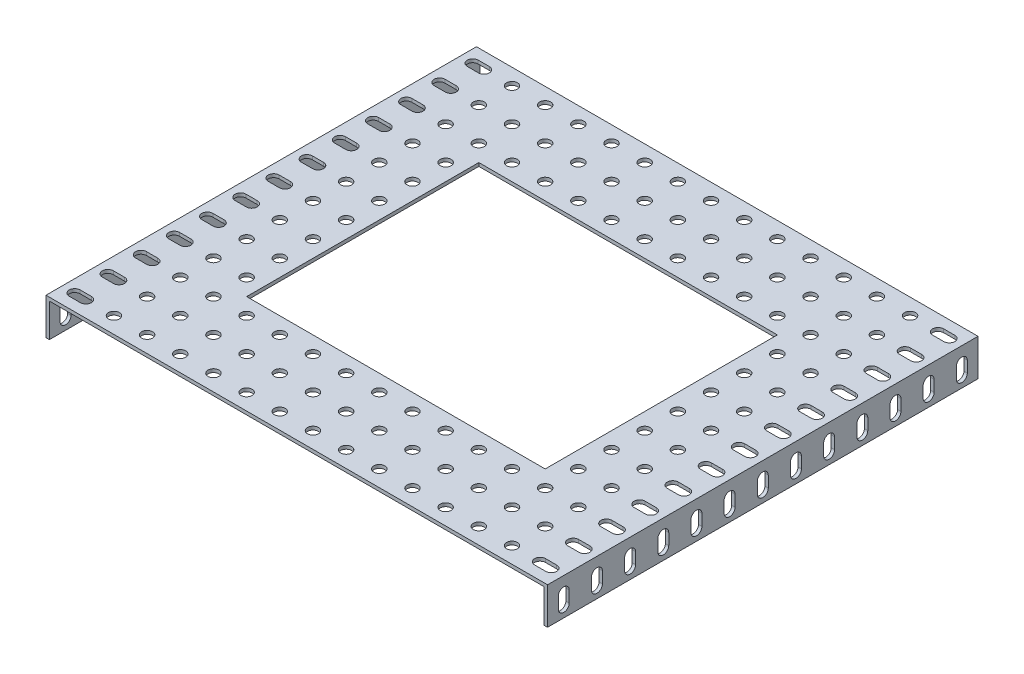
from build123d import *

# Parameters (mm, degrees)
SKETCH1_W           = 192.94
SKETCH1_H           = 165.58
SKETCH1_R           = 2.11
BOSS_EXTRUDE1_DEPTH = 1.3
SKETCH3_W           = 165.58
SKETCH3_H           = 14.16
BOSS_EXTRUDE2_DEPTH = 1.3
SKETCH4_W           = 114.84
SKETCH4_H           = 89.32
CUT_EXTRUDE1_DEPTH  = 10


with BuildPart() as part:
    # Sketch1 → Boss-Extrude1 (new body)
    with BuildSketch(Plane(origin=(0, 0, 0), x_dir=(1, 0, 0), z_dir=(0, 1, 0))):
        Rectangle(SKETCH1_W, SKETCH1_H)
        with Locations(Location((-76.56, -76.56, 0), (0, 0, 270))):
            Circle(SKETCH1_R, mode=Mode.SUBTRACT)
        with Locations(Location((-63.8, -76.56, 0), (0, 0, 270))):
            Circle(SKETCH1_R, mode=Mode.SUBTRACT)
        with Locations(Location((-51.04, -76.56, 0), (0, 0, 270))):
            Circle(SKETCH1_R, mode=Mode.SUBTRACT)
        with Locations(Location((-38.28, -76.56, 0), (0, 0, 270))):
            Circle(SKETCH1_R, mode=Mode.SUBTRACT)
        with Locations(Location((-25.52, -76.56, 0), (0, 0, 270))):
            Circle(SKETCH1_R, mode=Mode.SUBTRACT)
        with Locations(Location((-12.76, -76.56, 0), (0, 0, 270))):
            Circle(SKETCH1_R, mode=Mode.SUBTRACT)
        with Locations(Location((0, -76.56, 0), (0, 0, 270))):
            Circle(SKETCH1_R, mode=Mode.SUBTRACT)
        with Locations(Location((12.76, -76.56, 0), (0, 0, 270))):
            Circle(SKETCH1_R, mode=Mode.SUBTRACT)
        with Locations(Location((25.52, -76.56, 0), (0, 0, 270))):
            Circle(SKETCH1_R, mode=Mode.SUBTRACT)
        with Locations(Location((38.28, -76.56, 0), (0, 0, 270))):
            Circle(SKETCH1_R, mode=Mode.SUBTRACT)
        with Locations(Location((51.04, -76.56, 0), (0, 0, 270))):
            Circle(SKETCH1_R, mode=Mode.SUBTRACT)
        with Locations(Location((63.8, -76.56, 0), (0, 0, 270))):
            Circle(SKETCH1_R, mode=Mode.SUBTRACT)
        with Locations(Location((76.56, -76.56, 0), (0, 0, 270))):
            Circle(SKETCH1_R, mode=Mode.SUBTRACT)
        with Locations(Location((-63.8, -63.8, 0), (0, 0, 270))):
            Circle(SKETCH1_R, mode=Mode.SUBTRACT)
        with Locations(Location((-51.04, -63.8, 0), (0, 0, 270))):
            Circle(SKETCH1_R, mode=Mode.SUBTRACT)
        with Locations(Location((-38.28, -63.8, 0), (0, 0, 270))):
            Circle(SKETCH1_R, mode=Mode.SUBTRACT)
        with Locations(Location((-25.52, -63.8, 0), (0, 0, 270))):
            Circle(SKETCH1_R, mode=Mode.SUBTRACT)
        with Locations(Location((-12.76, -63.8, 0), (0, 0, 270))):
            Circle(SKETCH1_R, mode=Mode.SUBTRACT)
        with Locations(Location((0, -63.8, 0), (0, 0, 270))):
            Circle(SKETCH1_R, mode=Mode.SUBTRACT)
        with Locations(Location((12.76, -63.8, 0), (0, 0, 270))):
            Circle(SKETCH1_R, mode=Mode.SUBTRACT)
        with Locations(Location((25.52, -63.8, 0), (0, 0, 270))):
            Circle(SKETCH1_R, mode=Mode.SUBTRACT)
        with Locations(Location((38.28, -63.8, 0), (0, 0, 270))):
            Circle(SKETCH1_R, mode=Mode.SUBTRACT)
        with Locations(Location((51.04, -63.8, 0), (0, 0, 270))):
            Circle(SKETCH1_R, mode=Mode.SUBTRACT)
        with Locations(Location((63.8, -63.8, 0), (0, 0, 270))):
            Circle(SKETCH1_R, mode=Mode.SUBTRACT)
        with Locations(Location((76.56, -63.8, 0), (0, 0, 270))):
            Circle(SKETCH1_R, mode=Mode.SUBTRACT)
        with Locations(Location((-63.8, -51.04, 0), (0, 0, 270))):
            Circle(SKETCH1_R, mode=Mode.SUBTRACT)
        with Locations(Location((-51.04, -51.04, 0), (0, 0, 270))):
            Circle(SKETCH1_R, mode=Mode.SUBTRACT)
        with Locations(Location((-38.28, -51.04, 0), (0, 0, 270))):
            Circle(SKETCH1_R, mode=Mode.SUBTRACT)
        with Locations(Location((-25.52, -51.04, 0), (0, 0, 270))):
            Circle(SKETCH1_R, mode=Mode.SUBTRACT)
        with Locations(Location((-12.76, -51.04, 0), (0, 0, 270))):
            Circle(SKETCH1_R, mode=Mode.SUBTRACT)
        with Locations(Location((0, -51.04, 0), (0, 0, 270))):
            Circle(SKETCH1_R, mode=Mode.SUBTRACT)
        with Locations(Location((12.76, -51.04, 0), (0, 0, 270))):
            Circle(SKETCH1_R, mode=Mode.SUBTRACT)
        with Locations(Location((25.52, -51.04, 0), (0, 0, 270))):
            Circle(SKETCH1_R, mode=Mode.SUBTRACT)
        with Locations(Location((38.28, -51.04, 0), (0, 0, 270))):
            Circle(SKETCH1_R, mode=Mode.SUBTRACT)
        with Locations(Location((51.04, -51.04, 0), (0, 0, 270))):
            Circle(SKETCH1_R, mode=Mode.SUBTRACT)
        with Locations(Location((63.8, -51.04, 0), (0, 0, 270))):
            Circle(SKETCH1_R, mode=Mode.SUBTRACT)
        with Locations(Location((76.56, -51.04, 0), (0, 0, 270))):
            Circle(SKETCH1_R, mode=Mode.SUBTRACT)
        with Locations(Location((-63.8, -38.28, 0), (0, 0, 270))):
            Circle(SKETCH1_R, mode=Mode.SUBTRACT)
        with Locations(Location((-51.04, -38.28, 0), (0, 0, 270))):
            Circle(SKETCH1_R, mode=Mode.SUBTRACT)
        with Locations(Location((-38.28, -38.28, 0), (0, 0, 270))):
            Circle(SKETCH1_R, mode=Mode.SUBTRACT)
        with Locations(Location((-25.52, -38.28, 0), (0, 0, 270))):
            Circle(SKETCH1_R, mode=Mode.SUBTRACT)
        with Locations(Location((-12.76, -38.28, 0), (0, 0, 270))):
            Circle(SKETCH1_R, mode=Mode.SUBTRACT)
        with Locations(Location((0, -38.28, 0), (0, 0, 270))):
            Circle(SKETCH1_R, mode=Mode.SUBTRACT)
        with Locations(Location((12.76, -38.28, 0), (0, 0, 270))):
            Circle(SKETCH1_R, mode=Mode.SUBTRACT)
        with Locations(Location((25.52, -38.28, 0), (0, 0, 270))):
            Circle(SKETCH1_R, mode=Mode.SUBTRACT)
        with Locations(Location((38.28, -38.28, 0), (0, 0, 270))):
            Circle(SKETCH1_R, mode=Mode.SUBTRACT)
        with Locations(Location((51.04, -38.28, 0), (0, 0, 270))):
            Circle(SKETCH1_R, mode=Mode.SUBTRACT)
        with Locations(Location((63.8, -38.28, 0), (0, 0, 270))):
            Circle(SKETCH1_R, mode=Mode.SUBTRACT)
        with Locations(Location((76.56, -38.28, 0), (0, 0, 270))):
            Circle(SKETCH1_R, mode=Mode.SUBTRACT)
        with Locations(Location((-63.8, -25.52, 0), (0, 0, 270))):
            Circle(SKETCH1_R, mode=Mode.SUBTRACT)
        with Locations(Location((-51.04, -25.52, 0), (0, 0, 270))):
            Circle(SKETCH1_R, mode=Mode.SUBTRACT)
        with Locations(Location((-38.28, -25.52, 0), (0, 0, 270))):
            Circle(SKETCH1_R, mode=Mode.SUBTRACT)
        with Locations(Location((-25.52, -25.52, 0), (0, 0, 270))):
            Circle(SKETCH1_R, mode=Mode.SUBTRACT)
        with Locations(Location((-12.76, -25.52, 0), (0, 0, 270))):
            Circle(SKETCH1_R, mode=Mode.SUBTRACT)
        with Locations(Location((0, -25.52, 0), (0, 0, 270))):
            Circle(SKETCH1_R, mode=Mode.SUBTRACT)
        with Locations(Location((12.76, -25.52, 0), (0, 0, 270))):
            Circle(SKETCH1_R, mode=Mode.SUBTRACT)
        with Locations(Location((25.52, -25.52, 0), (0, 0, 270))):
            Circle(SKETCH1_R, mode=Mode.SUBTRACT)
        with Locations(Location((38.28, -25.52, 0), (0, 0, 270))):
            Circle(SKETCH1_R, mode=Mode.SUBTRACT)
        with Locations(Location((51.04, -25.52, 0), (0, 0, 270))):
            Circle(SKETCH1_R, mode=Mode.SUBTRACT)
        with Locations(Location((63.8, -25.52, 0), (0, 0, 270))):
            Circle(SKETCH1_R, mode=Mode.SUBTRACT)
        with Locations(Location((76.56, -25.52, 0), (0, 0, 270))):
            Circle(SKETCH1_R, mode=Mode.SUBTRACT)
        with Locations(Location((-63.8, -12.76, 0), (0, 0, 270))):
            Circle(SKETCH1_R, mode=Mode.SUBTRACT)
        with Locations(Location((-51.04, -12.76, 0), (0, 0, 270))):
            Circle(SKETCH1_R, mode=Mode.SUBTRACT)
        with Locations(Location((-38.28, -12.76, 0), (0, 0, 270))):
            Circle(SKETCH1_R, mode=Mode.SUBTRACT)
        with Locations(Location((-25.52, -12.76, 0), (0, 0, 270))):
            Circle(SKETCH1_R, mode=Mode.SUBTRACT)
        with Locations(Location((-12.76, -12.76, 0), (0, 0, 270))):
            Circle(SKETCH1_R, mode=Mode.SUBTRACT)
        with Locations(Location((0, -12.76, 0), (0, 0, 270))):
            Circle(SKETCH1_R, mode=Mode.SUBTRACT)
        with Locations(Location((12.76, -12.76, 0), (0, 0, 270))):
            Circle(SKETCH1_R, mode=Mode.SUBTRACT)
        with Locations(Location((25.52, -12.76, 0), (0, 0, 270))):
            Circle(SKETCH1_R, mode=Mode.SUBTRACT)
        with Locations(Location((38.28, -12.76, 0), (0, 0, 270))):
            Circle(SKETCH1_R, mode=Mode.SUBTRACT)
        with Locations(Location((51.04, -12.76, 0), (0, 0, 270))):
            Circle(SKETCH1_R, mode=Mode.SUBTRACT)
        with Locations(Location((63.8, -12.76, 0), (0, 0, 270))):
            Circle(SKETCH1_R, mode=Mode.SUBTRACT)
        with Locations(Location((76.56, -12.76, 0), (0, 0, 270))):
            Circle(SKETCH1_R, mode=Mode.SUBTRACT)
        with Locations(Location((-63.8, 0, 0), (0, 0, 270))):
            Circle(SKETCH1_R, mode=Mode.SUBTRACT)
        with Locations(Location((-51.04, 0, 0), (0, 0, 270))):
            Circle(SKETCH1_R, mode=Mode.SUBTRACT)
        with Locations(Location((-38.28, 0, 0), (0, 0, 270))):
            Circle(SKETCH1_R, mode=Mode.SUBTRACT)
        with Locations(Location((-25.52, 0, 0), (0, 0, 270))):
            Circle(SKETCH1_R, mode=Mode.SUBTRACT)
        with Locations(Location((-12.76, 0, 0), (0, 0, 270))):
            Circle(SKETCH1_R, mode=Mode.SUBTRACT)
        with Locations(Location((0, 0, 0), (0, 0, 270))):
            Circle(SKETCH1_R, mode=Mode.SUBTRACT)
        with Locations(Location((12.76, 0, 0), (0, 0, 270))):
            Circle(SKETCH1_R, mode=Mode.SUBTRACT)
        with Locations(Location((25.52, 0, 0), (0, 0, 270))):
            Circle(SKETCH1_R, mode=Mode.SUBTRACT)
        with Locations(Location((38.28, 0, 0), (0, 0, 270))):
            Circle(SKETCH1_R, mode=Mode.SUBTRACT)
        with Locations(Location((51.04, 0, 0), (0, 0, 270))):
            Circle(SKETCH1_R, mode=Mode.SUBTRACT)
        with Locations(Location((63.8, 0, 0), (0, 0, 270))):
            Circle(SKETCH1_R, mode=Mode.SUBTRACT)
        with Locations(Location((76.56, 0, 0), (0, 0, 270))):
            Circle(SKETCH1_R, mode=Mode.SUBTRACT)
        with Locations(Location((-63.8, 12.76, 0), (0, 0, 270))):
            Circle(SKETCH1_R, mode=Mode.SUBTRACT)
        with Locations(Location((-51.04, 12.76, 0), (0, 0, 270))):
            Circle(SKETCH1_R, mode=Mode.SUBTRACT)
        with Locations(Location((-38.28, 12.76, 0), (0, 0, 270))):
            Circle(SKETCH1_R, mode=Mode.SUBTRACT)
        with Locations(Location((-25.52, 12.76, 0), (0, 0, 270))):
            Circle(SKETCH1_R, mode=Mode.SUBTRACT)
        with Locations(Location((-12.76, 12.76, 0), (0, 0, 270))):
            Circle(SKETCH1_R, mode=Mode.SUBTRACT)
        with Locations(Location((0, 12.76, 0), (0, 0, 270))):
            Circle(SKETCH1_R, mode=Mode.SUBTRACT)
        with Locations(Location((12.76, 12.76, 0), (0, 0, 270))):
            Circle(SKETCH1_R, mode=Mode.SUBTRACT)
        with Locations(Location((25.52, 12.76, 0), (0, 0, 270))):
            Circle(SKETCH1_R, mode=Mode.SUBTRACT)
        with Locations(Location((38.28, 12.76, 0), (0, 0, 270))):
            Circle(SKETCH1_R, mode=Mode.SUBTRACT)
        with Locations(Location((51.04, 12.76, 0), (0, 0, 270))):
            Circle(SKETCH1_R, mode=Mode.SUBTRACT)
        with Locations(Location((63.8, 12.76, 0), (0, 0, 270))):
            Circle(SKETCH1_R, mode=Mode.SUBTRACT)
        with Locations(Location((76.56, 12.76, 0), (0, 0, 270))):
            Circle(SKETCH1_R, mode=Mode.SUBTRACT)
        with Locations(Location((-63.8, 25.52, 0), (0, 0, 270))):
            Circle(SKETCH1_R, mode=Mode.SUBTRACT)
        with Locations(Location((-51.04, 25.52, 0), (0, 0, 270))):
            Circle(SKETCH1_R, mode=Mode.SUBTRACT)
        with Locations(Location((-38.28, 25.52, 0), (0, 0, 270))):
            Circle(SKETCH1_R, mode=Mode.SUBTRACT)
        with Locations(Location((-25.52, 25.52, 0), (0, 0, 270))):
            Circle(SKETCH1_R, mode=Mode.SUBTRACT)
        with Locations(Location((-12.76, 25.52, 0), (0, 0, 270))):
            Circle(SKETCH1_R, mode=Mode.SUBTRACT)
        with Locations(Location((0, 25.52, 0), (0, 0, 270))):
            Circle(SKETCH1_R, mode=Mode.SUBTRACT)
        with Locations(Location((12.76, 25.52, 0), (0, 0, 270))):
            Circle(SKETCH1_R, mode=Mode.SUBTRACT)
        with Locations(Location((25.52, 25.52, 0), (0, 0, 270))):
            Circle(SKETCH1_R, mode=Mode.SUBTRACT)
        with Locations(Location((38.28, 25.52, 0), (0, 0, 270))):
            Circle(SKETCH1_R, mode=Mode.SUBTRACT)
        with Locations(Location((51.04, 25.52, 0), (0, 0, 270))):
            Circle(SKETCH1_R, mode=Mode.SUBTRACT)
        with Locations(Location((63.8, 25.52, 0), (0, 0, 270))):
            Circle(SKETCH1_R, mode=Mode.SUBTRACT)
        with Locations(Location((76.56, 25.52, 0), (0, 0, 270))):
            Circle(SKETCH1_R, mode=Mode.SUBTRACT)
        with Locations(Location((-63.8, 38.28, 0), (0, 0, 270))):
            Circle(SKETCH1_R, mode=Mode.SUBTRACT)
        with Locations(Location((-51.04, 38.28, 0), (0, 0, 270))):
            Circle(SKETCH1_R, mode=Mode.SUBTRACT)
        with Locations(Location((-38.28, 38.28, 0), (0, 0, 270))):
            Circle(SKETCH1_R, mode=Mode.SUBTRACT)
        with Locations(Location((-25.52, 38.28, 0), (0, 0, 270))):
            Circle(SKETCH1_R, mode=Mode.SUBTRACT)
        with Locations(Location((-12.76, 38.28, 0), (0, 0, 270))):
            Circle(SKETCH1_R, mode=Mode.SUBTRACT)
        with Locations(Location((0, 38.28, 0), (0, 0, 270))):
            Circle(SKETCH1_R, mode=Mode.SUBTRACT)
        with Locations(Location((12.76, 38.28, 0), (0, 0, 270))):
            Circle(SKETCH1_R, mode=Mode.SUBTRACT)
        with Locations(Location((25.52, 38.28, 0), (0, 0, 270))):
            Circle(SKETCH1_R, mode=Mode.SUBTRACT)
        with Locations(Location((38.28, 38.28, 0), (0, 0, 270))):
            Circle(SKETCH1_R, mode=Mode.SUBTRACT)
        with Locations(Location((51.04, 38.28, 0), (0, 0, 270))):
            Circle(SKETCH1_R, mode=Mode.SUBTRACT)
        with Locations(Location((63.8, 38.28, 0), (0, 0, 270))):
            Circle(SKETCH1_R, mode=Mode.SUBTRACT)
        with Locations(Location((76.56, 38.28, 0), (0, 0, 270))):
            Circle(SKETCH1_R, mode=Mode.SUBTRACT)
        with Locations(Location((-63.8, 51.04, 0), (0, 0, 270))):
            Circle(SKETCH1_R, mode=Mode.SUBTRACT)
        with Locations(Location((-51.04, 51.04, 0), (0, 0, 270))):
            Circle(SKETCH1_R, mode=Mode.SUBTRACT)
        with Locations(Location((-38.28, 51.04, 0), (0, 0, 270))):
            Circle(SKETCH1_R, mode=Mode.SUBTRACT)
        with Locations(Location((-25.52, 51.04, 0), (0, 0, 270))):
            Circle(SKETCH1_R, mode=Mode.SUBTRACT)
        with Locations(Location((-12.76, 51.04, 0), (0, 0, 270))):
            Circle(SKETCH1_R, mode=Mode.SUBTRACT)
        with Locations(Location((0, 51.04, 0), (0, 0, 270))):
            Circle(SKETCH1_R, mode=Mode.SUBTRACT)
        with Locations(Location((12.76, 51.04, 0), (0, 0, 270))):
            Circle(SKETCH1_R, mode=Mode.SUBTRACT)
        with Locations(Location((25.52, 51.04, 0), (0, 0, 270))):
            Circle(SKETCH1_R, mode=Mode.SUBTRACT)
        with Locations(Location((38.28, 51.04, 0), (0, 0, 270))):
            Circle(SKETCH1_R, mode=Mode.SUBTRACT)
        with Locations(Location((51.04, 51.04, 0), (0, 0, 270))):
            Circle(SKETCH1_R, mode=Mode.SUBTRACT)
        with Locations(Location((63.8, 51.04, 0), (0, 0, 270))):
            Circle(SKETCH1_R, mode=Mode.SUBTRACT)
        with Locations(Location((76.56, 51.04, 0), (0, 0, 270))):
            Circle(SKETCH1_R, mode=Mode.SUBTRACT)
        with Locations(Location((-63.8, 63.8, 0), (0, 0, 270))):
            Circle(SKETCH1_R, mode=Mode.SUBTRACT)
        with Locations(Location((-51.04, 63.8, 0), (0, 0, 270))):
            Circle(SKETCH1_R, mode=Mode.SUBTRACT)
        with Locations(Location((-38.28, 63.8, 0), (0, 0, 270))):
            Circle(SKETCH1_R, mode=Mode.SUBTRACT)
        with Locations(Location((-25.52, 63.8, 0), (0, 0, 270))):
            Circle(SKETCH1_R, mode=Mode.SUBTRACT)
        with Locations(Location((-12.76, 63.8, 0), (0, 0, 270))):
            Circle(SKETCH1_R, mode=Mode.SUBTRACT)
        with Locations(Location((0, 63.8, 0), (0, 0, 270))):
            Circle(SKETCH1_R, mode=Mode.SUBTRACT)
        with Locations(Location((12.76, 63.8, 0), (0, 0, 270))):
            Circle(SKETCH1_R, mode=Mode.SUBTRACT)
        with Locations(Location((25.52, 63.8, 0), (0, 0, 270))):
            Circle(SKETCH1_R, mode=Mode.SUBTRACT)
        with Locations(Location((38.28, 63.8, 0), (0, 0, 270))):
            Circle(SKETCH1_R, mode=Mode.SUBTRACT)
        with Locations(Location((51.04, 63.8, 0), (0, 0, 270))):
            Circle(SKETCH1_R, mode=Mode.SUBTRACT)
        with Locations(Location((63.8, 63.8, 0), (0, 0, 270))):
            Circle(SKETCH1_R, mode=Mode.SUBTRACT)
        with Locations(Location((76.56, 63.8, 0), (0, 0, 270))):
            Circle(SKETCH1_R, mode=Mode.SUBTRACT)
        with Locations(Location((-63.8, 76.56, 0), (0, 0, 270))):
            Circle(SKETCH1_R, mode=Mode.SUBTRACT)
        with Locations(Location((-51.04, 76.56, 0), (0, 0, 270))):
            Circle(SKETCH1_R, mode=Mode.SUBTRACT)
        with Locations(Location((-38.28, 76.56, 0), (0, 0, 270))):
            Circle(SKETCH1_R, mode=Mode.SUBTRACT)
        with Locations(Location((-25.52, 76.56, 0), (0, 0, 270))):
            Circle(SKETCH1_R, mode=Mode.SUBTRACT)
        with Locations(Location((-12.76, 76.56, 0), (0, 0, 270))):
            Circle(SKETCH1_R, mode=Mode.SUBTRACT)
        with Locations(Location((0, 76.56, 0), (0, 0, 270))):
            Circle(SKETCH1_R, mode=Mode.SUBTRACT)
        with Locations(Location((12.76, 76.56, 0), (0, 0, 270))):
            Circle(SKETCH1_R, mode=Mode.SUBTRACT)
        with Locations(Location((25.52, 76.56, 0), (0, 0, 270))):
            Circle(SKETCH1_R, mode=Mode.SUBTRACT)
        with Locations(Location((38.28, 76.56, 0), (0, 0, 270))):
            Circle(SKETCH1_R, mode=Mode.SUBTRACT)
        with Locations(Location((51.04, 76.56, 0), (0, 0, 270))):
            Circle(SKETCH1_R, mode=Mode.SUBTRACT)
        with Locations(Location((63.8, 76.56, 0), (0, 0, 270))):
            Circle(SKETCH1_R, mode=Mode.SUBTRACT)
        with Locations(Location((76.56, 76.56, 0), (0, 0, 270))):
            Circle(SKETCH1_R, mode=Mode.SUBTRACT)
        with Locations(Location((-76.56, -63.8, 0), (0, 0, 270))):
            Circle(SKETCH1_R, mode=Mode.SUBTRACT)
        with Locations(Location((-76.56, -51.04, 0), (0, 0, 270))):
            Circle(SKETCH1_R, mode=Mode.SUBTRACT)
        with Locations(Location((-76.56, -38.28, 0), (0, 0, 270))):
            Circle(SKETCH1_R, mode=Mode.SUBTRACT)
        with Locations(Location((-76.56, -25.52, 0), (0, 0, 270))):
            Circle(SKETCH1_R, mode=Mode.SUBTRACT)
        with Locations(Location((-76.56, -12.76, 0), (0, 0, 270))):
            Circle(SKETCH1_R, mode=Mode.SUBTRACT)
        with Locations(Location((-76.56, 0, 0), (0, 0, 270))):
            Circle(SKETCH1_R, mode=Mode.SUBTRACT)
        with Locations(Location((-76.56, 12.76, 0), (0, 0, 270))):
            Circle(SKETCH1_R, mode=Mode.SUBTRACT)
        with Locations(Location((-76.56, 25.52, 0), (0, 0, 270))):
            Circle(SKETCH1_R, mode=Mode.SUBTRACT)
        with Locations(Location((-76.56, 38.28, 0), (0, 0, 270))):
            Circle(SKETCH1_R, mode=Mode.SUBTRACT)
        with Locations(Location((-76.56, 51.04, 0), (0, 0, 270))):
            Circle(SKETCH1_R, mode=Mode.SUBTRACT)
        with Locations(Location((-76.56, 63.8, 0), (0, 0, 270))):
            Circle(SKETCH1_R, mode=Mode.SUBTRACT)
        with Locations(Location((-76.56, 76.56, 0), (0, 0, 270))):
            Circle(SKETCH1_R, mode=Mode.SUBTRACT)
        with BuildLine():
            Line((-91.66, 78.67), (-87.36, 78.67))
            ThreePointArc((-87.36, 78.67), (-85.25, 76.56), (-87.36, 74.45))
            Line((-87.36, 74.45), (-91.66, 74.45))
            ThreePointArc((-91.66, 74.45), (-93.77, 76.56), (-91.66, 78.67))
        make_face(mode=Mode.SUBTRACT)
        with BuildLine():
            Line((-91.66, 65.91), (-87.36, 65.91))
            ThreePointArc((-87.36, 65.91), (-85.25, 63.8), (-87.36, 61.69))
            Line((-87.36, 61.69), (-91.66, 61.69))
            ThreePointArc((-91.66, 61.69), (-93.77, 63.8), (-91.66, 65.91))
        make_face(mode=Mode.SUBTRACT)
        with BuildLine():
            Line((-91.66, 53.15), (-87.36, 53.15))
            ThreePointArc((-87.36, 53.15), (-85.25, 51.04), (-87.36, 48.93))
            Line((-87.36, 48.93), (-91.66, 48.93))
            ThreePointArc((-91.66, 48.93), (-93.77, 51.04), (-91.66, 53.15))
        make_face(mode=Mode.SUBTRACT)
        with BuildLine():
            Line((-91.66, 40.39), (-87.36, 40.39))
            ThreePointArc((-87.36, 40.39), (-85.25, 38.28), (-87.36, 36.17))
            Line((-87.36, 36.17), (-91.66, 36.17))
            ThreePointArc((-91.66, 36.17), (-93.77, 38.28), (-91.66, 40.39))
        make_face(mode=Mode.SUBTRACT)
        with BuildLine():
            Line((-91.66, 27.63), (-87.36, 27.63))
            ThreePointArc((-87.36, 27.63), (-85.25, 25.52), (-87.36, 23.41))
            Line((-87.36, 23.41), (-91.66, 23.41))
            ThreePointArc((-91.66, 23.41), (-93.77, 25.52), (-91.66, 27.63))
        make_face(mode=Mode.SUBTRACT)
        with BuildLine():
            Line((-91.66, 14.87), (-87.36, 14.87))
            ThreePointArc((-87.36, 14.87), (-85.25, 12.76), (-87.36, 10.65))
            Line((-87.36, 10.65), (-91.66, 10.65))
            ThreePointArc((-91.66, 10.65), (-93.77, 12.76), (-91.66, 14.87))
        make_face(mode=Mode.SUBTRACT)
        with BuildLine():
            Line((-91.66, 2.11), (-87.36, 2.11))
            ThreePointArc((-87.36, 2.11), (-85.25, 0), (-87.36, -2.11))
            Line((-87.36, -2.11), (-91.66, -2.11))
            ThreePointArc((-91.66, -2.11), (-93.77, 0), (-91.66, 2.11))
        make_face(mode=Mode.SUBTRACT)
        with BuildLine():
            Line((-91.66, -10.65), (-87.36, -10.65))
            ThreePointArc((-87.36, -10.65), (-85.25, -12.76), (-87.36, -14.87))
            Line((-87.36, -14.87), (-91.66, -14.87))
            ThreePointArc((-91.66, -14.87), (-93.77, -12.76), (-91.66, -10.65))
        make_face(mode=Mode.SUBTRACT)
        with BuildLine():
            Line((-91.66, -23.41), (-87.36, -23.41))
            ThreePointArc((-87.36, -23.41), (-85.25, -25.52), (-87.36, -27.63))
            Line((-87.36, -27.63), (-91.66, -27.63))
            ThreePointArc((-91.66, -27.63), (-93.77, -25.52), (-91.66, -23.41))
        make_face(mode=Mode.SUBTRACT)
        with BuildLine():
            Line((-91.66, -36.17), (-87.36, -36.17))
            ThreePointArc((-87.36, -36.17), (-85.25, -38.28), (-87.36, -40.39))
            Line((-87.36, -40.39), (-91.66, -40.39))
            ThreePointArc((-91.66, -40.39), (-93.77, -38.28), (-91.66, -36.17))
        make_face(mode=Mode.SUBTRACT)
        with BuildLine():
            Line((-91.66, -48.93), (-87.36, -48.93))
            ThreePointArc((-87.36, -48.93), (-85.25, -51.04), (-87.36, -53.15))
            Line((-87.36, -53.15), (-91.66, -53.15))
            ThreePointArc((-91.66, -53.15), (-93.77, -51.04), (-91.66, -48.93))
        make_face(mode=Mode.SUBTRACT)
        with BuildLine():
            Line((-91.66, -61.69), (-87.36, -61.69))
            ThreePointArc((-87.36, -61.69), (-85.25, -63.8), (-87.36, -65.91))
            Line((-87.36, -65.91), (-91.66, -65.91))
            ThreePointArc((-91.66, -65.91), (-93.77, -63.8), (-91.66, -61.69))
        make_face(mode=Mode.SUBTRACT)
        with BuildLine():
            Line((-91.66, -74.45), (-87.36, -74.45))
            ThreePointArc((-87.36, -74.45), (-85.25, -76.56), (-87.36, -78.67))
            Line((-87.36, -78.67), (-91.66, -78.67))
            ThreePointArc((-91.66, -78.67), (-93.77, -76.56), (-91.66, -74.45))
        make_face(mode=Mode.SUBTRACT)
        with BuildLine():
            Line((91.66, 78.67), (87.36, 78.67))
            ThreePointArc((87.36, 78.67), (85.25, 76.56), (87.36, 74.45))
            Line((87.36, 74.45), (91.66, 74.45))
            ThreePointArc((91.66, 74.45), (93.77, 76.56), (91.66, 78.67))
        make_face(mode=Mode.SUBTRACT)
        with BuildLine():
            Line((91.66, 65.91), (87.36, 65.91))
            ThreePointArc((87.36, 65.91), (85.25, 63.8), (87.36, 61.69))
            Line((87.36, 61.69), (91.66, 61.69))
            ThreePointArc((91.66, 61.69), (93.77, 63.8), (91.66, 65.91))
        make_face(mode=Mode.SUBTRACT)
        with BuildLine():
            Line((91.66, 53.15), (87.36, 53.15))
            ThreePointArc((87.36, 53.15), (85.25, 51.04), (87.36, 48.93))
            Line((87.36, 48.93), (91.66, 48.93))
            ThreePointArc((91.66, 48.93), (93.77, 51.04), (91.66, 53.15))
        make_face(mode=Mode.SUBTRACT)
        with BuildLine():
            Line((91.66, 40.39), (87.36, 40.39))
            ThreePointArc((87.36, 40.39), (85.25, 38.28), (87.36, 36.17))
            Line((87.36, 36.17), (91.66, 36.17))
            ThreePointArc((91.66, 36.17), (93.77, 38.28), (91.66, 40.39))
        make_face(mode=Mode.SUBTRACT)
        with BuildLine():
            Line((91.66, 27.63), (87.36, 27.63))
            ThreePointArc((87.36, 27.63), (85.25, 25.52), (87.36, 23.41))
            Line((87.36, 23.41), (91.66, 23.41))
            ThreePointArc((91.66, 23.41), (93.77, 25.52), (91.66, 27.63))
        make_face(mode=Mode.SUBTRACT)
        with BuildLine():
            Line((91.66, 14.87), (87.36, 14.87))
            ThreePointArc((87.36, 14.87), (85.25, 12.76), (87.36, 10.65))
            Line((87.36, 10.65), (91.66, 10.65))
            ThreePointArc((91.66, 10.65), (93.77, 12.76), (91.66, 14.87))
        make_face(mode=Mode.SUBTRACT)
        with BuildLine():
            Line((91.66, 2.11), (87.36, 2.11))
            ThreePointArc((87.36, 2.11), (85.25, 0), (87.36, -2.11))
            Line((87.36, -2.11), (91.66, -2.11))
            ThreePointArc((91.66, -2.11), (93.77, 0), (91.66, 2.11))
        make_face(mode=Mode.SUBTRACT)
        with BuildLine():
            Line((91.66, -10.65), (87.36, -10.65))
            ThreePointArc((87.36, -10.65), (85.25, -12.76), (87.36, -14.87))
            Line((87.36, -14.87), (91.66, -14.87))
            ThreePointArc((91.66, -14.87), (93.77, -12.76), (91.66, -10.65))
        make_face(mode=Mode.SUBTRACT)
        with BuildLine():
            Line((91.66, -23.41), (87.36, -23.41))
            ThreePointArc((87.36, -23.41), (85.25, -25.52), (87.36, -27.63))
            Line((87.36, -27.63), (91.66, -27.63))
            ThreePointArc((91.66, -27.63), (93.77, -25.52), (91.66, -23.41))
        make_face(mode=Mode.SUBTRACT)
        with BuildLine():
            Line((91.66, -36.17), (87.36, -36.17))
            ThreePointArc((87.36, -36.17), (85.25, -38.28), (87.36, -40.39))
            Line((87.36, -40.39), (91.66, -40.39))
            ThreePointArc((91.66, -40.39), (93.77, -38.28), (91.66, -36.17))
        make_face(mode=Mode.SUBTRACT)
        with BuildLine():
            Line((91.66, -48.93), (87.36, -48.93))
            ThreePointArc((87.36, -48.93), (85.25, -51.04), (87.36, -53.15))
            Line((87.36, -53.15), (91.66, -53.15))
            ThreePointArc((91.66, -53.15), (93.77, -51.04), (91.66, -48.93))
        make_face(mode=Mode.SUBTRACT)
        with BuildLine():
            Line((91.66, -61.69), (87.36, -61.69))
            ThreePointArc((87.36, -61.69), (85.25, -63.8), (87.36, -65.91))
            Line((87.36, -65.91), (91.66, -65.91))
            ThreePointArc((91.66, -65.91), (93.77, -63.8), (91.66, -61.69))
        make_face(mode=Mode.SUBTRACT)
        with BuildLine():
            Line((91.66, -74.45), (87.36, -74.45))
            ThreePointArc((87.36, -74.45), (85.25, -76.56), (87.36, -78.67))
            Line((87.36, -78.67), (91.66, -78.67))
            ThreePointArc((91.66, -78.67), (93.77, -76.56), (91.66, -74.45))
        make_face(mode=Mode.SUBTRACT)
    extrude(amount=-BOSS_EXTRUDE1_DEPTH)

    # Sketch3 → Boss-Extrude2 (add)
    with BuildSketch(Plane.ZY.offset(96.47)):
        with Locations((0, -7.08)):
            Rectangle(SKETCH3_W, SKETCH3_H)
        with BuildLine():
            Line((-74.45, -5.91), (-74.45, -10.21))
            ThreePointArc((-74.45, -10.21), (-76.56, -12.32), (-78.67, -10.21))
            Line((-78.67, -10.21), (-78.67, -5.91))
            ThreePointArc((-78.67, -5.91), (-76.56, -3.8), (-74.45, -5.91))
        make_face(mode=Mode.SUBTRACT)
        with BuildLine():
            Line((-61.69, -5.91), (-61.69, -10.21))
            ThreePointArc((-61.69, -10.21), (-63.8, -12.32), (-65.91, -10.21))
            Line((-65.91, -10.21), (-65.91, -5.91))
            ThreePointArc((-65.91, -5.91), (-63.8, -3.8), (-61.69, -5.91))
        make_face(mode=Mode.SUBTRACT)
        with BuildLine():
            Line((-48.93, -5.91), (-48.93, -10.21))
            ThreePointArc((-48.93, -10.21), (-51.04, -12.32), (-53.15, -10.21))
            Line((-53.15, -10.21), (-53.15, -5.91))
            ThreePointArc((-53.15, -5.91), (-51.04, -3.8), (-48.93, -5.91))
        make_face(mode=Mode.SUBTRACT)
        with BuildLine():
            Line((-36.17, -5.91), (-36.17, -10.21))
            ThreePointArc((-36.17, -10.21), (-38.28, -12.32), (-40.39, -10.21))
            Line((-40.39, -10.21), (-40.39, -5.91))
            ThreePointArc((-40.39, -5.91), (-38.28, -3.8), (-36.17, -5.91))
        make_face(mode=Mode.SUBTRACT)
        with BuildLine():
            Line((-23.41, -5.91), (-23.41, -10.21))
            ThreePointArc((-23.41, -10.21), (-25.52, -12.32), (-27.63, -10.21))
            Line((-27.63, -10.21), (-27.63, -5.91))
            ThreePointArc((-27.63, -5.91), (-25.52, -3.8), (-23.41, -5.91))
        make_face(mode=Mode.SUBTRACT)
        with BuildLine():
            Line((-10.65, -5.91), (-10.65, -10.21))
            ThreePointArc((-10.65, -10.21), (-12.76, -12.32), (-14.87, -10.21))
            Line((-14.87, -10.21), (-14.87, -5.91))
            ThreePointArc((-14.87, -5.91), (-12.76, -3.8), (-10.65, -5.91))
        make_face(mode=Mode.SUBTRACT)
        with BuildLine():
            Line((2.11, -5.91), (2.11, -10.21))
            ThreePointArc((2.11, -10.21), (0, -12.32), (-2.11, -10.21))
            Line((-2.11, -10.21), (-2.11, -5.91))
            ThreePointArc((-2.11, -5.91), (0, -3.8), (2.11, -5.91))
        make_face(mode=Mode.SUBTRACT)
        with BuildLine():
            Line((14.87, -5.91), (14.87, -10.21))
            ThreePointArc((14.87, -10.21), (12.76, -12.32), (10.65, -10.21))
            Line((10.65, -10.21), (10.65, -5.91))
            ThreePointArc((10.65, -5.91), (12.76, -3.8), (14.87, -5.91))
        make_face(mode=Mode.SUBTRACT)
        with BuildLine():
            Line((27.63, -5.91), (27.63, -10.21))
            ThreePointArc((27.63, -10.21), (25.52, -12.32), (23.41, -10.21))
            Line((23.41, -10.21), (23.41, -5.91))
            ThreePointArc((23.41, -5.91), (25.52, -3.8), (27.63, -5.91))
        make_face(mode=Mode.SUBTRACT)
        with BuildLine():
            Line((40.39, -5.91), (40.39, -10.21))
            ThreePointArc((40.39, -10.21), (38.28, -12.32), (36.17, -10.21))
            Line((36.17, -10.21), (36.17, -5.91))
            ThreePointArc((36.17, -5.91), (38.28, -3.8), (40.39, -5.91))
        make_face(mode=Mode.SUBTRACT)
        with BuildLine():
            Line((53.15, -5.91), (53.15, -10.21))
            ThreePointArc((53.15, -10.21), (51.04, -12.32), (48.93, -10.21))
            Line((48.93, -10.21), (48.93, -5.91))
            ThreePointArc((48.93, -5.91), (51.04, -3.8), (53.15, -5.91))
        make_face(mode=Mode.SUBTRACT)
        with BuildLine():
            Line((65.91, -5.91), (65.91, -10.21))
            ThreePointArc((65.91, -10.21), (63.8, -12.32), (61.69, -10.21))
            Line((61.69, -10.21), (61.69, -5.91))
            ThreePointArc((61.69, -5.91), (63.8, -3.8), (65.91, -5.91))
        make_face(mode=Mode.SUBTRACT)
        with BuildLine():
            Line((78.67, -5.91), (78.67, -10.21))
            ThreePointArc((78.67, -10.21), (76.56, -12.32), (74.45, -10.21))
            Line((74.45, -10.21), (74.45, -5.91))
            ThreePointArc((74.45, -5.91), (76.56, -3.8), (78.67, -5.91))
        make_face(mode=Mode.SUBTRACT)
    boss_extrude2 = extrude(amount=-BOSS_EXTRUDE2_DEPTH)

    # Mirror1: Boss-Extrude2 across plane
    add(boss_extrude2.mirror(Plane(origin=(0, 0, 0), x_dir=(0, 0, 1), z_dir=(1, 0, 0))))

    # Sketch4 → Cut-Extrude1 (cut)
    with BuildSketch(Plane(origin=(0, 0, 0), x_dir=(1, 0, 0), z_dir=(0, 1, 0))):
        Rectangle(SKETCH4_W, SKETCH4_H)
    extrude(amount=-CUT_EXTRUDE1_DEPTH, mode=Mode.SUBTRACT)


solid = part.part
